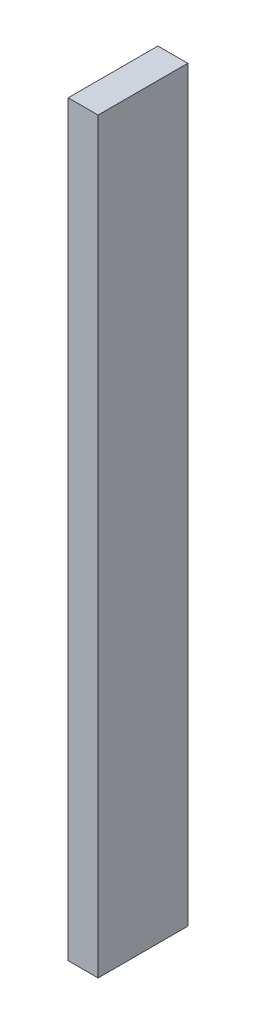
from build123d import *

# Parameters (mm, degrees)
SKETCH1_W           = 20
SKETCH1_H           = 60
BOSS_EXTRUDE1_DEPTH = 500


with BuildPart() as part:
    # Sketch1 → Boss-Extrude1 (new body)
    with BuildSketch(Plane(origin=(0, 0, 0), x_dir=(1, 0, 0), z_dir=(0, 1, 0))):
        Rectangle(SKETCH1_W, SKETCH1_H)
    extrude(amount=BOSS_EXTRUDE1_DEPTH)


solid = part.part
